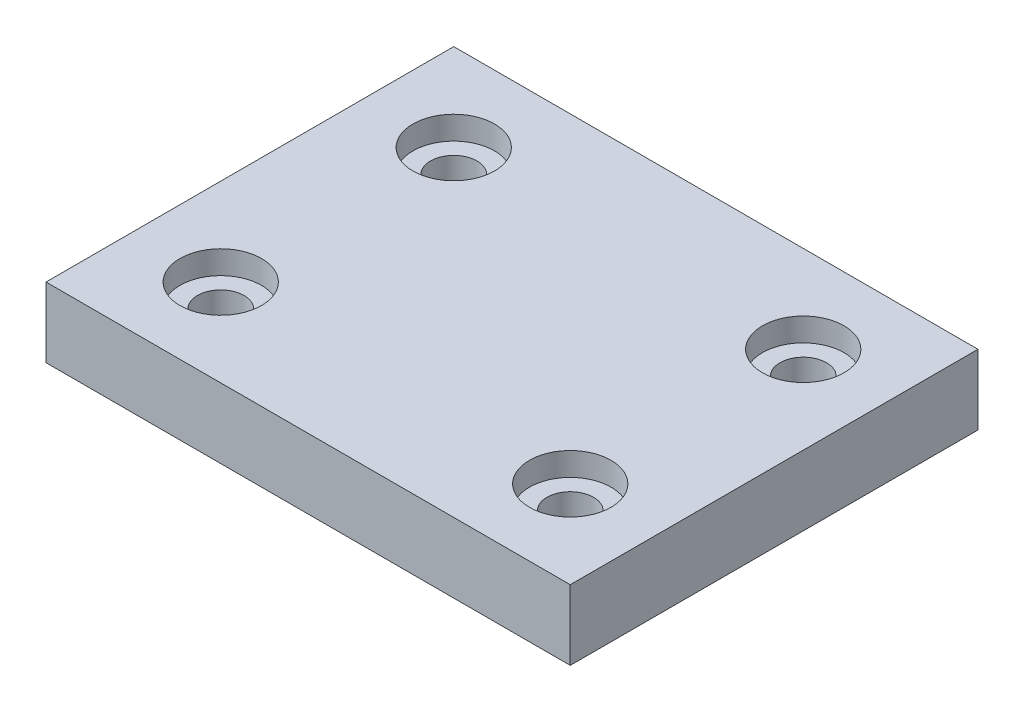
from build123d import *

# Parameters (mm, degrees)
SKETCH_1_W          = 90
SKETCH_1_H          = 70
EXTRUDE_1_DEPTH     = 12
SKETCH_2_R          = 7
CUT_EXTRUDE_1_DEPTH = 4
SKETCH_3_R          = 4
CUT_EXTRUDE_2_DEPTH = 59.258046655


with BuildPart() as part:
    # 草图1 → 凸台-拉伸1 (new body)
    with BuildSketch(Plane(origin=(0, 0, 0), x_dir=(1, 0, 0), z_dir=(0, 1, 0))):
        Rectangle(SKETCH_1_W, SKETCH_1_H)
    extrude(amount=EXTRUDE_1_DEPTH)

    # 草图2 → 切除-拉伸1 (cut)
    with BuildSketch(Plane(origin=(0, 12, 0), x_dir=(1, 0, 0), z_dir=(0, 1, 0))):
        with Locations(Location((-30, 20, 0), (0, 0, 270))):
            Circle(SKETCH_2_R)
        with Locations(Location((30, 20, 0), (0, 0, 270))):
            Circle(SKETCH_2_R)
        with Locations(Location((-30, -20, 0), (0, 0, 270))):
            Circle(SKETCH_2_R)
        with Locations(Location((30, -20, 0), (0, 0, 270))):
            Circle(SKETCH_2_R)
    extrude(amount=-CUT_EXTRUDE_1_DEPTH, mode=Mode.SUBTRACT)

    # 草图3 → 切除-拉伸2 (cut, through all)
    with BuildSketch(Plane(origin=(0, 12, 0), x_dir=(1, 0, 0), z_dir=(0, 1, 0))):
        with Locations(Location((-30, 20, 0), (0, 0, 270))):
            Circle(SKETCH_3_R)
        with Locations(Location((30, 20, 0), (0, 0, 270))):
            Circle(SKETCH_3_R)
        with Locations(Location((-30, -20, 0), (0, 0, 270))):
            Circle(SKETCH_3_R)
        with Locations(Location((30, -20, 0), (0, 0, 270))):
            Circle(SKETCH_3_R)
    extrude(amount=-CUT_EXTRUDE_2_DEPTH, mode=Mode.SUBTRACT)


solid = part.part
